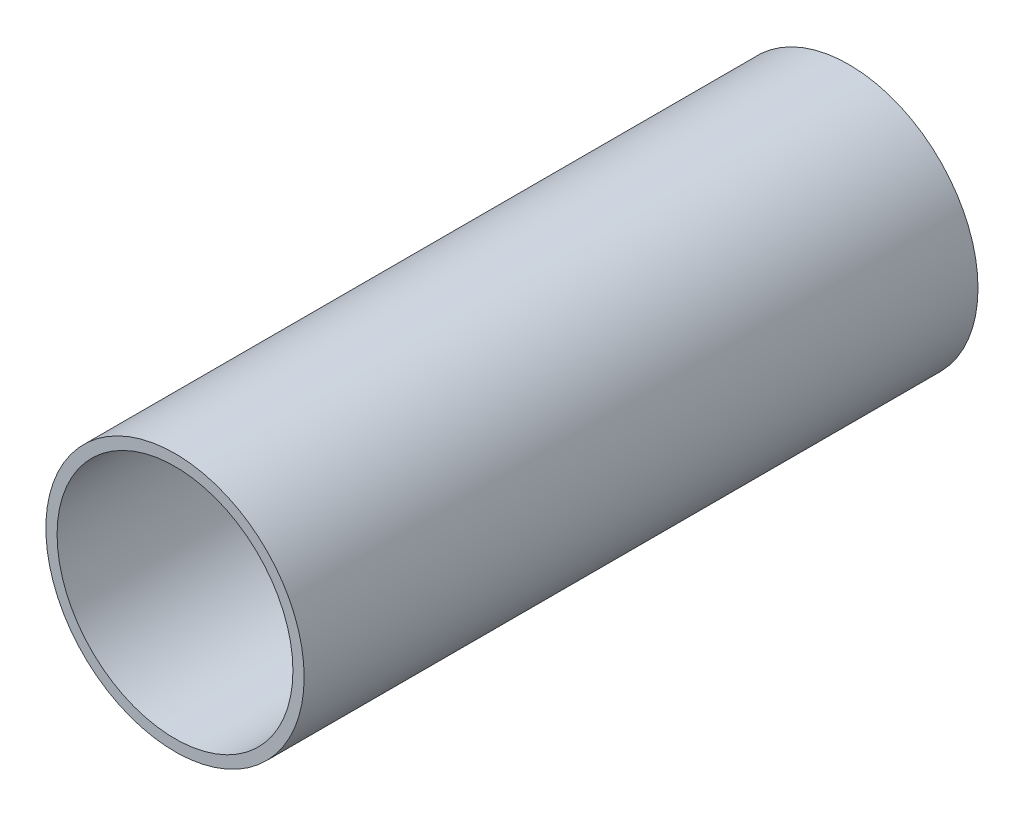
from build123d import *

# Parameters (mm, degrees)
ESQUISSE1_R        = 57.5
ESQUISSE1_R_2      = 52.5
BOSS_EXTRU_1_DEPTH = 300


with BuildPart() as part:
    # Esquisse1 → Boss.-Extru.1 (new body)
    with BuildSketch(Plane.XY):
        Circle(ESQUISSE1_R)
        Circle(ESQUISSE1_R_2, mode=Mode.SUBTRACT)
    extrude(amount=BOSS_EXTRU_1_DEPTH)


solid = part.part
